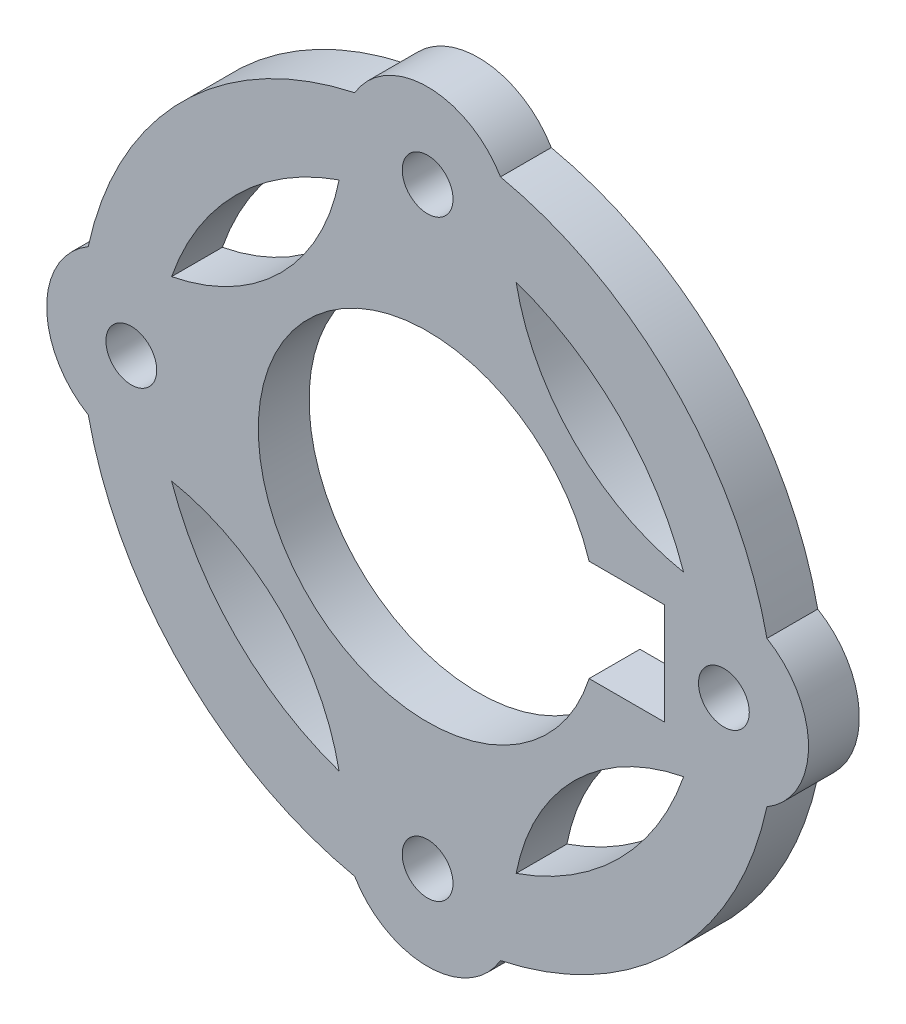
from build123d import *

# Parameters (mm, degrees)
CROQUIS2_R              = 1.5
CROQUIS2_R_2            = 10
SALIENTE_EXTRUIR2_DEPTH = 3
CROQUIS4_W              = 8
CROQUIS4_H              = 6
CORTAR_EXTRUIR1_DEPTH   = 32.960913629


with BuildPart() as part:
    # Croquis2 → Saliente-Extruir2 (new body)
    with BuildSketch(Plane.XY):
        with BuildLine():
            ThreePointArc((-4.305099018, -20.042857143), (0, -22.5), (4.305099018, -20.042857143))
            ThreePointArc((4.305099018, -20.042857143), (14.495689014, -14.495689014), (20.042857143, -4.305099018))
            ThreePointArc((20.042857143, -4.305099018), (22.5, 0), (20.042857143, 4.305099018))
            ThreePointArc((20.042857143, 4.305099018), (14.495689014, 14.495689014), (4.305099018, 20.042857143))
            ThreePointArc((4.305099018, 20.042857143), (0, 22.5), (-4.305099018, 20.042857143))
            ThreePointArc((-4.305099018, 20.042857143), (-14.495689014, 14.495689014), (-20.042857143, 4.305099018))
            ThreePointArc((-20.042857143, 4.305099018), (-22.5, 0), (-20.042857143, -4.305099018))
            ThreePointArc((-20.042857143, -4.305099018), (-14.495689014, -14.495689014), (-4.305099018, -20.042857143))
        make_face()
        with BuildLine():
            ThreePointArc((-15.121652909, -5.228347091), (-8.661165235, -8.661165235), (-5.228347091, -15.121652909))
            ThreePointArc((-5.228347091, -15.121652909), (-11.313708499, -11.313708499), (-15.121652909, -5.228347091))
        make_face(mode=Mode.SUBTRACT)
        with Locations((0, -17.5)):
            Circle(CROQUIS2_R, mode=Mode.SUBTRACT)
        with BuildLine():
            ThreePointArc((15.121652909, -5.228347091), (11.313708499, -11.313708499), (5.228347091, -15.121652909))
            ThreePointArc((5.228347091, -15.121652909), (8.661165235, -8.661165235), (15.121652909, -5.228347091))
        make_face(mode=Mode.SUBTRACT)
        with Locations((-17.5, 0)):
            Circle(CROQUIS2_R, mode=Mode.SUBTRACT)
        with BuildLine():
            ThreePointArc((-15.121652909, 5.228347091), (-11.313708499, 11.313708499), (-5.228347091, 15.121652909))
            ThreePointArc((-5.228347091, 15.121652909), (-8.661165235, 8.661165235), (-15.121652909, 5.228347091))
        make_face(mode=Mode.SUBTRACT)
        Circle(CROQUIS2_R_2, mode=Mode.SUBTRACT)
        with Locations((17.5, 0)):
            Circle(CROQUIS2_R, mode=Mode.SUBTRACT)
        with Locations((0, 17.5)):
            Circle(CROQUIS2_R, mode=Mode.SUBTRACT)
        with BuildLine():
            ThreePointArc((5.228347091, 15.121652909), (11.313708499, 11.313708499), (15.121652909, 5.228347091))
            ThreePointArc((15.121652909, 5.228347091), (8.661165235, 8.661165235), (5.228347091, 15.121652909))
        make_face(mode=Mode.SUBTRACT)
    extrude(amount=SALIENTE_EXTRUIR2_DEPTH)

    # Croquis4 → Cortar-Extruir1 (cut, through all)
    with BuildSketch(Plane(origin=(0, 0, 0), x_dir=(-1, 0, 0), z_dir=(0, 0, -1))):
        with Locations((-10, 0)):
            Rectangle(CROQUIS4_W, CROQUIS4_H)
    extrude(amount=-CORTAR_EXTRUIR1_DEPTH, mode=Mode.SUBTRACT)


solid = part.part
